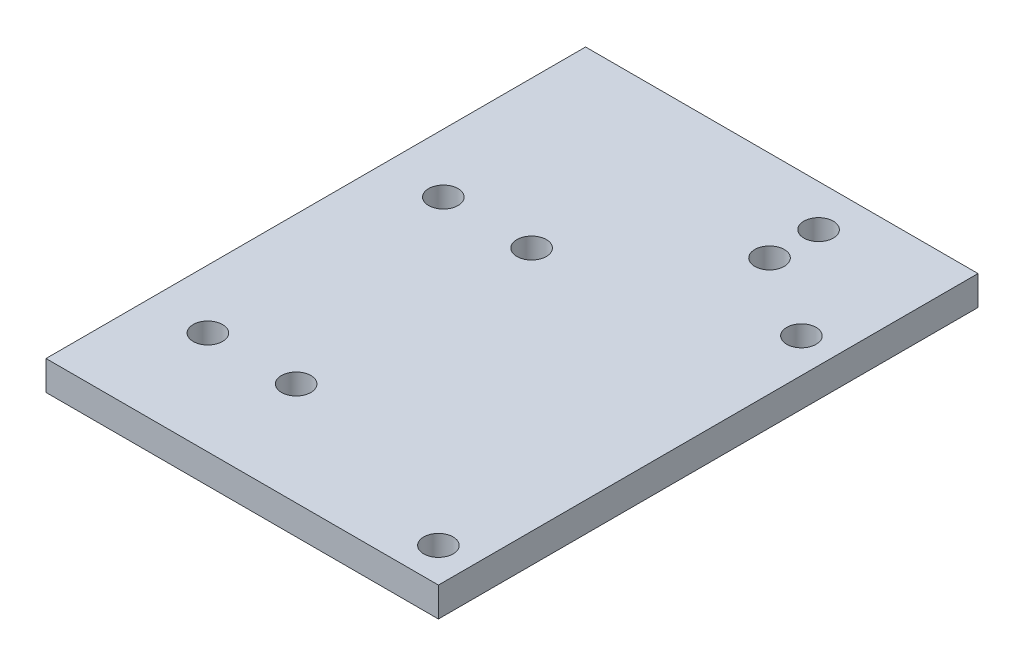
from build123d import *

# Parameters (mm, degrees)
SKETCH1_W           = 40
SKETCH1_H           = 55
BOSS_EXTRUDE1_DEPTH = 3
SKETCH2_R           = 1.5
CUT_EXTRUDE1_DEPTH  = 3


with BuildPart() as part:
    # Sketch1 → Boss-Extrude1 (new body)
    with BuildSketch(Plane(origin=(0, 0, 0), x_dir=(1, 0, 0), z_dir=(0, 1, 0))):
        with Locations((21.857541899, 2.737430168)):
            Rectangle(SKETCH1_W, SKETCH1_H)
    extrude(amount=BOSS_EXTRUDE1_DEPTH)

    # Sketch2 → Cut-Extrude1 (cut)
    with BuildSketch(Plane(origin=(0, 3, 0), x_dir=(1, 0, 0), z_dir=(0, 1, 0))):
        with Locations(Location((38.357541899, -21.262569832, 0), (0, 0, 270))):
            Circle(SKETCH2_R)
        with Locations(Location((38.357541899, 15.737430168, 0), (0, 0, 270))):
            Circle(SKETCH2_R)
        with Locations(Location((16.857541899, -14.262569832, 0), (0, 0, 270))):
            Circle(SKETCH2_R)
        with Locations(Location((7.857541899, -14.262569832, 0), (0, 0, 270))):
            Circle(SKETCH2_R)
        with Locations(Location((7.857541899, 9.737430168, 0), (0, 0, 270))):
            Circle(SKETCH2_R)
        with Locations(Location((16.857541899, 9.737430168, 0), (0, 0, 270))):
            Circle(SKETCH2_R)
        with Locations(Location((29.857541899, 20.987430168, 0), (0, 0, 270))):
            Circle(SKETCH2_R)
        with Locations(Location((29.857541899, 25.987430168, 0), (0, 0, 270))):
            Circle(SKETCH2_R)
    extrude(amount=-CUT_EXTRUDE1_DEPTH, mode=Mode.SUBTRACT)


solid = part.part
